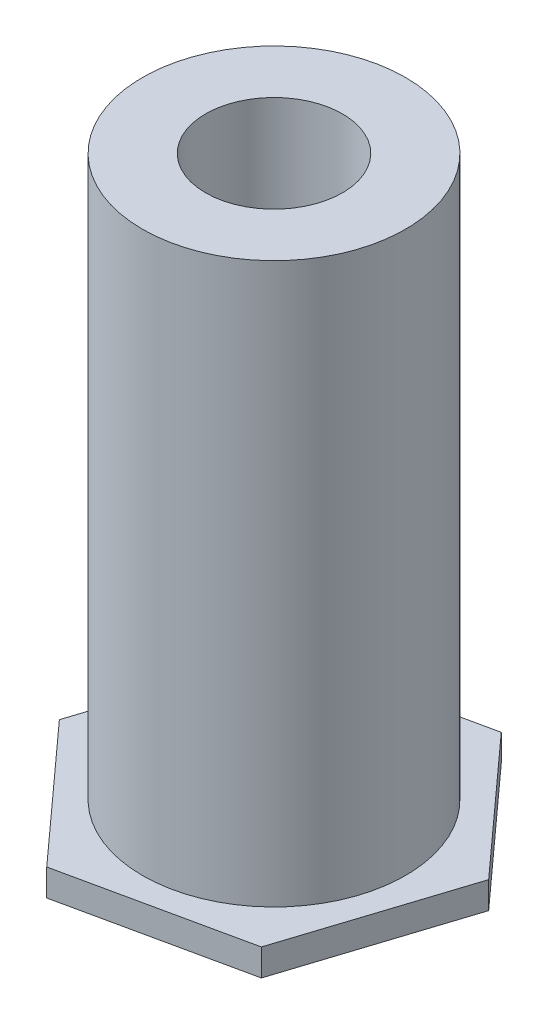
from build123d import *

# Parameters (mm, degrees)
RESSALTO_EXTRUS_O1_DEPTH = 0.55
ESBO_O2_R                = 2.69
ESBO_O2_R_2              = 1.4
RESSALTO_EXTRUS_O2_DEPTH = 11.45


with BuildPart() as part:
    # Esboço1 → Ressalto-extrusão1 (new body)
    with BuildSketch(Plane(origin=(0, 0, 0), x_dir=(1, 0, 0), z_dir=(0, 1, 0))):
        Polygon((2.480405511, -2.738781085), (3.612056751, 0.778703642), (1.13165124, 3.517484727), (-2.480405511, 2.738781085), (-3.612056751, -0.778703642), (-1.13165124, -3.517484727), align=None)
    extrude(amount=RESSALTO_EXTRUS_O1_DEPTH)

    # Esboço2 → Ressalto-extrusão2 (add)
    with BuildSketch(Plane(origin=(0, 0.55, 0), x_dir=(1, 0, 0), z_dir=(0, 1, 0))):
        with Locations(Location((0, 0, 0), (0, 0, 270))):
            Circle(ESBO_O2_R)
        with Locations(Location((0, 0, 0), (0, 0, 270))):
            Circle(ESBO_O2_R_2, mode=Mode.SUBTRACT)
    extrude(amount=RESSALTO_EXTRUS_O2_DEPTH)


solid = part.part
